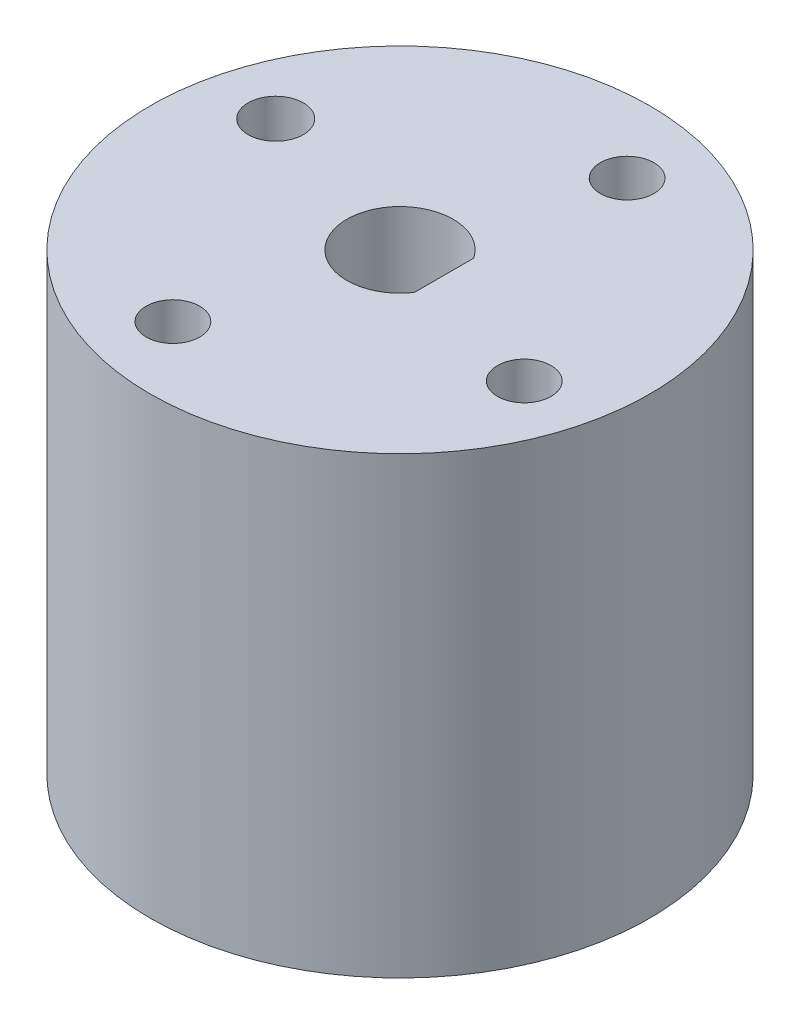
from build123d import *

# Parameters (mm, degrees)
SKETCH1_R           = 13.97
SKETCH1_R_2         = 1.5
SKETCH1_R_3         = 1.543928493
BOSS_EXTRUDE1_DEPTH = 25.4
CUT_EXTRUDE1_DEPTH  = 30


with BuildPart() as part:
    # Sketch1 → Boss-Extrude1 (new body)
    with BuildSketch(Plane(origin=(0, 0, 0), x_dir=(1, 0, 0), z_dir=(0, 1, 0))):
        with Locations(Location((0, 0, 0), (0, 0, 270))):
            Circle(SKETCH1_R)
        with Locations(Location((2.876226708, 9.828189808, 0), (0, 0, 270))):
            Circle(SKETCH1_R_2, mode=Mode.SUBTRACT)
        with Locations(Location((-9.828189808, 2.876226708, 0), (0, 0, 270))):
            Circle(SKETCH1_R_3, mode=Mode.SUBTRACT)
        with Locations(Location((-2.876226708, -9.828189808, 0), (0, 0, 270))):
            Circle(SKETCH1_R_2, mode=Mode.SUBTRACT)
        with Locations(Location((9.828189808, -2.876226708, 0), (0, 0, 270))):
            Circle(SKETCH1_R_2, mode=Mode.SUBTRACT)
    extrude(amount=BOSS_EXTRUDE1_DEPTH)

    # Sketch2 → Cut-Extrude1 (cut)
    with BuildSketch(Plane(origin=(0, 25.4, 0), x_dir=(1, 0, 0), z_dir=(0, 1, 0))):
        with BuildLine():
            Line((2.465312915, -1.66), (2.465312915, 1.66))
            ThreePointArc((2.465312915, 1.66), (-2.97209821, 0), (2.465312915, -1.66))
        make_face()
    extrude(amount=-CUT_EXTRUDE1_DEPTH, mode=Mode.SUBTRACT)


solid = part.part
